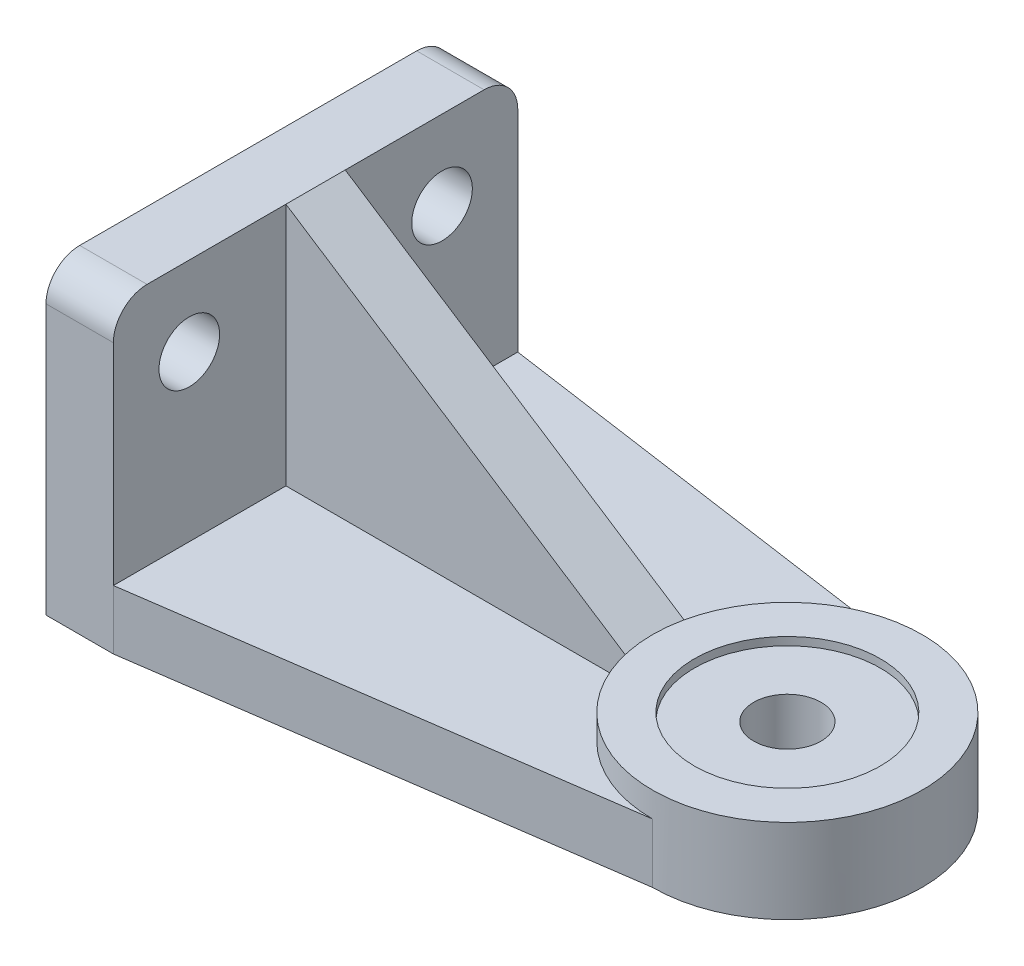
from build123d import *

# Parameters (mm, degrees)
SKETCH1_R                                            = 25.4
BOSS_EXTRUDE1_DEPTH                                  = 15.875
BOSS_EXTRUDE2_DEPTH                                  = 11.176
SKETCH3_W                                            = 12.7
SKETCH3_H                                            = 76.2
BOSS_EXTRUDE3_DEPTH                                  = 57.15
CBORE_FOR_3_8_BINDING_HEAD_MACHINE_SCREW_D           = 12.7
CBORE_FOR_3_8_BINDING_HEAD_MACHINE_SCREW_CBORE_D     = 35.052
CBORE_FOR_3_8_BINDING_HEAD_MACHINE_SCREW_CBORE_DEPTH = 1.524
BOSS_EXTRUDE7_DEPTH                                  = 5.588
F_25_64_0_45_DIAMETER_HOLE1_D                        = 11.43
FILLET1_R                                            = 6.35


with BuildPart() as part:
    # Sketch1 → Boss-Extrude1 (new body)
    with BuildSketch(Plane(origin=(0, 0, 0), x_dir=(1, 0, 0), z_dir=(0, 1, 0))):
        with Locations(Location((0, 0, 0), (0, 0, 270))):
            Circle(SKETCH1_R)
    extrude(amount=BOSS_EXTRUDE1_DEPTH)

    # Sketch2 → Boss-Extrude2 (add)
    with BuildSketch(Plane(origin=(0, 0, 0), x_dir=(1, 0, 0), z_dir=(0, 1, 0))):
        with BuildLine():
            Line((-88.9, 38.1), (-88.9, -38.1))
            Line((-88.9, -38.1), (0, -25.4))
            ThreePointArc((0, -25.4), (-25.4, 0), (0, 25.4))
            Line((0, 25.4), (-88.9, 38.1))
        make_face()
    extrude(amount=BOSS_EXTRUDE2_DEPTH)

    # Sketch3 → Boss-Extrude3 (add)
    with BuildSketch(Plane(origin=(0, 0, 0), x_dir=(1, 0, 0), z_dir=(0, 1, 0))):
        with Locations((-95.25, 0)):
            Rectangle(SKETCH3_W, SKETCH3_H)
    extrude(amount=BOSS_EXTRUDE3_DEPTH)

    # CBORE for 3/8 Binding Head Machine Screw1 (through all)
    with Locations(Plane.ZX.offset(15.875)):
        with Locations((0, 0)):
            CounterBoreHole(CBORE_FOR_3_8_BINDING_HEAD_MACHINE_SCREW_D / 2, CBORE_FOR_3_8_BINDING_HEAD_MACHINE_SCREW_CBORE_D / 2, CBORE_FOR_3_8_BINDING_HEAD_MACHINE_SCREW_CBORE_DEPTH)

    # Sketch10 → Boss-Extrude7 (add, symmetric)
    with BuildSketch(Plane.XY):
        Polygon((-88.9, 57.15), (-25.4, 15.875), (-22.86, 14.224), (-22.86, 11.176), (-88.9, 11.176), align=None)
    extrude(amount=BOSS_EXTRUDE7_DEPTH, both=True)

    # 25/64 (0.45) Diameter Hole1 (through all)
    with Locations(Plane(origin=(-88.9, 42.164, 23.7998), x_dir=(0, 0, 1), z_dir=(1, 0, 0))):
        with Locations((0, 0), (-47.625, 0)):
            Hole(F_25_64_0_45_DIAMETER_HOLE1_D / 2)

    # Fillet1
    fillet1_edges = [part.edges().sort_by_distance(p)[0] for p in [
        (-95.25, 57.15, -38.1),
        (-95.25, 57.15, 38.1),
    ]]
    fillet(fillet1_edges, radius=FILLET1_R)


solid = part.part
